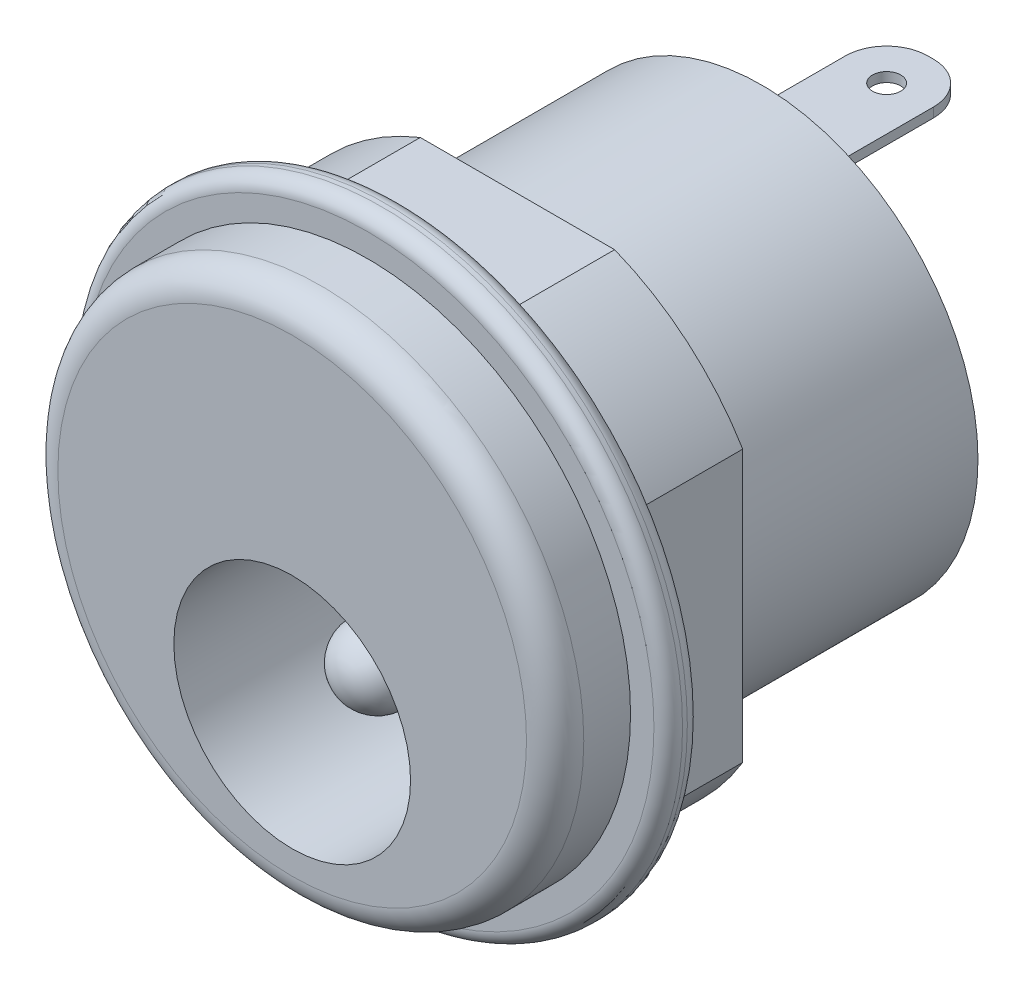
from build123d import *

# Parameters (mm, degrees)
SKETCH2_W                    = 10.4902
SKETCH2_H                    = 5.7531
SKETCH3_W                    = 3.0988
SKETCH3_H                    = 1.2446
SKETCH4_R                    = 3.1496
CUT_EXTRUDE1_DEPTH           = 8.89
SKETCH5_R                    = 1
BOSS_EXTRUDE1_DEPTH          = 7.62
FILLET1_R                    = 1
SKETCH6_W                    = 2.35
SKETCH6_H                    = 0.254
SKETCH6_W_2                  = 0.254
SKETCH6_H_2                  = 2.35
EXTRUDE_THIN1_DEPTH          = 4.4958
FILLET2_R                    = 1.1
F_0_75_0_75_DIAMETER_HOLE1_D = 0.75
F_0_75_0_75_DIAMETER_HOLE2_D = 0.75
SKETCH16_OUTSIDE_W           = 23.662
SKETCH16_OUTSIDE_H           = 23.662
SKETCH16_OUTSIDE_W_2         = 11.9888
SKETCH16_OUTSIDE_H_2         = 13.0048
CUT_EXTRUDE2_DEPTH           = 9.6012


with BuildPart() as part:
    # Sketch2 → Revolve1 (revolve)
    with BuildSketch(Plane(origin=(0, 0, 0), x_dir=(0, 0, -1), z_dir=(1, 0, 0)), mode=Mode.PRIVATE) as revolve1_sk:
        with BuildLine():
            Line((-2.0066, 0), (0, 0))
            Line((0, 0), (0, 5.7531))
            Line((0, 5.7531), (0, 6.9977))
            Line((0, 6.9977), (-1.2446, 6.9977))
            ThreePointArc((-1.2446, 6.9977), (-1.783415367, 6.774515367), (-2.0066, 6.2357))
            Line((-2.0066, 6.2357), (-2.0066, 0))
        make_face()
        with Locations((5.2451, 2.87655)):
            Rectangle(SKETCH2_W, SKETCH2_H)
    revolve(revolve1_sk.sketch.rotate(Axis((0, 0, 7.880629527), (0, 0, -1)), 90), axis=Axis((0, 0, 7.880629527), (0, 0, -1)))

    # Sketch4 → Cut-Extrude1 (cut)
    with BuildSketch(Plane.XY.offset(2.0066)):
        with Locations((0, -2.4511)):
            Circle(SKETCH4_R)
    extrude(amount=-CUT_EXTRUDE1_DEPTH, mode=Mode.SUBTRACT)


with BuildPart() as body_2:
    # Sketch3 → Revolve2 (revolve)
    with BuildSketch(Plane(origin=(0, 0, 0), x_dir=(0, 0, -1), z_dir=(1, 0, 0)), mode=Mode.PRIVATE) as revolve2_sk:
        with Locations((2.4384, 6.3754)):
            Rectangle(SKETCH3_W, SKETCH3_H)
        with BuildLine():
            ThreePointArc((0, 7.62), (0.111592316, 7.889407684), (0.381, 8.001))
            Line((0.381, 8.001), (0.508, 8.001))
            ThreePointArc((0.508, 8.001), (0.777407684, 7.889407684), (0.889, 7.62))
            Line((0.889, 7.62), (0.889, 5.7531))
            Line((0.889, 5.7531), (0, 5.7531))
            Line((0, 5.7531), (0, 7.62))
        make_face()
    revolve(revolve2_sk.sketch.rotate(Axis((0, 0, 6.77031441), (0, 0, -1)), 90), axis=Axis((0, 0, 6.77031441), (0, 0, -1)))


    add(part.part)  # Boss-Extrude1 merges part
    # Sketch5 → Boss-Extrude1 (add)
    with BuildSketch(Plane.XY.offset(-6.8834)):
        with Locations(Location((0, -2.4511, 0), (0, 0, 180))):
            Circle(SKETCH5_R)
    extrude(amount=BOSS_EXTRUDE1_DEPTH)

    # Fillet1
    fillet1_edges = [body_2.edges().sort_by_distance(p)[0] for p in [
        (1, -2.4511, 0.7366),
    ]]
    fillet(fillet1_edges, radius=FILLET1_R)

    # Sketch6 → Extrude-Thin1 (add)
    with BuildSketch(Plane(origin=(0, 0, -10.4902), x_dir=(-1, 0, 0), z_dir=(0, 0, -1))):
        with Locations((0, 4.010257453)):
            Rectangle(SKETCH6_W, SKETCH6_H)
        with Locations((2.568957238, 0)):
            Rectangle(SKETCH6_W_2, SKETCH6_H_2)
    extrude(amount=EXTRUDE_THIN1_DEPTH)

    # Fillet2
    fillet2_edges = [body_2.edges().sort_by_distance(p)[0] for p in [
        (-1.175, 4.010257453, -14.986),
        (1.175, 4.010257453, -14.986),
        (-2.568957238, -1.175, -14.986),
        (-2.568957238, 1.175, -14.986),
    ]]
    fillet(fillet2_edges, radius=FILLET2_R)

    # Ø0.75 (0.75) Diameter Hole1 (through all)
    with Locations(Plane(origin=(-2.441957238, 0, 0), x_dir=(0, 0, -1), z_dir=(1, 0, 0))):
        with Locations((13.811758, 0)):
            Hole(F_0_75_0_75_DIAMETER_HOLE1_D / 2)

    # Ø0.75 (0.75) Diameter Hole2 (through all)
    with Locations(Plane(origin=(0, 4.137257453, 0), x_dir=(1, 0, 0), z_dir=(0, 1, 0))):
        with Locations((0, 13.811758)):
            Hole(F_0_75_0_75_DIAMETER_HOLE2_D / 2)

    # Sketch16 outside → Cut-Extrude2 (cut)
    with BuildSketch(Plane(origin=(0, 0, -10.4902), x_dir=(-1, 0, 0), z_dir=(0, 0, -1))):
        Rectangle(SKETCH16_OUTSIDE_W, SKETCH16_OUTSIDE_H)
        Rectangle(SKETCH16_OUTSIDE_W_2, SKETCH16_OUTSIDE_H_2, mode=Mode.SUBTRACT)
    extrude(amount=-CUT_EXTRUDE2_DEPTH, mode=Mode.SUBTRACT)


solid = body_2.part
